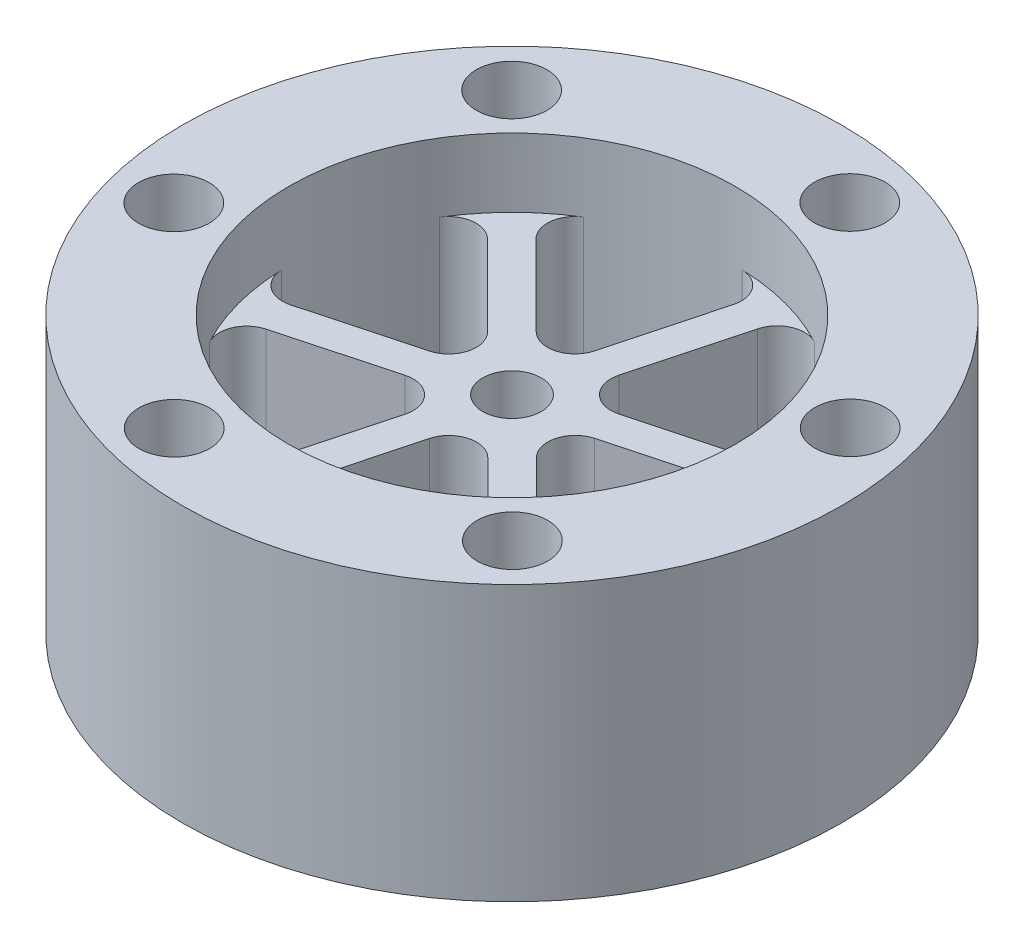
from build123d import *

# Parameters (mm, degrees)
SKETCH1_R                = 30.48
BOSS_EXTRUDE1_DEPTH      = 25.4
F_1_4_28_TAPPED_HOLE1_D  = 5.4102
F_1_4_CLEARANCE_HOLE2_D  = 6.5278
CUT_EXTRUDE1_DEPTH       = 51.032197633
FILLET1_R                = 2.54
CIRPATTERN1_COUNT        = 6
FILLET1_OF_CIRPATTERN1_R = 2.54
SKETCH8_R                = 20.6502
CUT_EXTRUDE2_DEPTH       = 6.35


with BuildPart() as part:
    # Sketch1 → Boss-Extrude1 (new body)
    with BuildSketch(Plane(origin=(0, 0, 0), x_dir=(1, 0, 0), z_dir=(0, 1, 0))):
        with Locations(Location((0, 0, 0), (0, 0, 270))):
            Circle(SKETCH1_R)
    extrude(amount=BOSS_EXTRUDE1_DEPTH)

    # 1/4-28 Tapped Hole1 (through all)
    with Locations(Plane(origin=(0, 25.4, 0), x_dir=(1, 0, 0), z_dir=(0, 1, 0))):
        with Locations((0, 0)):
            Hole(F_1_4_28_TAPPED_HOLE1_D / 2)

    # 1/4 Clearance Hole2 (through all)
    with Locations(Plane(origin=(0, 0, 0), x_dir=(-1, 0, 0), z_dir=(0, -1, 0))):
        with Locations((269.174368783, -128.772908827), (-18.058184892, -18.021920393), (6.578348439, -24.649807059), (-24.636533331, 6.627886666), (-6.578348439, 24.649807059), (18.058184892, 18.021920393), (24.636533331, -6.627886666)):
            Hole(F_1_4_CLEARANCE_HOLE2_D / 2)

    # Sketch7 → Cut-Extrude1 (cut, through all)
    with BuildSketch(Plane(origin=(0, 25.4, 0), x_dir=(1, 0, 0), z_dir=(0, 1, 0))):
        with BuildLine():
            Line((-13.451907307, 15.667704039), (-0.82483254, 3.065987))
            Line((-0.82483254, 3.065987), (3.775037164, 20.302213043))
            ThreePointArc((3.775037164, 20.302213043), (-5.364710837, 19.941179445), (-13.451907307, 15.667704039))
        make_face()
    cut_extrude1 = extrude(amount=-CUT_EXTRUDE1_DEPTH, mode=Mode.SUBTRACT)

    # Fillet1
    fillet1_edges = [part.edges().sort_by_distance(p)[0] for p in [
        (-13.451907307, 12.7, -15.667704039),
        (3.775037164, 12.7, -20.302213043),
        (-0.82483254, 12.7, -3.065987),
    ]]
    fillet(fillet1_edges, radius=FILLET1_R)

    # CirPattern1: Cut-Extrude1 ×6 about axis
    cirpattern1_axis = Axis((0, 0, 0), (0, 1, 0))
    for i in range(1, CIRPATTERN1_COUNT):
        add(cut_extrude1.rotate(cirpattern1_axis, i * 360 / CIRPATTERN1_COUNT), mode=Mode.SUBTRACT)

    # Fillet1 of CirPattern1
    fillet1_of_cirpattern1_edges = [part.edges().sort_by_distance(p)[0] for p in [
        (-20.29458337, 12.7, 3.815841438),
        (-15.694713666, 12.7, -13.420384606),
        (-3.067638899, 12.7, -0.818667567),
        (-6.842676063, 12.7, 19.483545477),
        (-19.46975083, 12.7, 6.881828437),
        (-2.24280636, 12.7, 2.247319433),
        (13.451907307, 12.7, 15.667704039),
        (-3.775037164, 12.7, 20.302213043),
        (0.82483254, 12.7, 3.065987),
        (20.29458337, 12.7, -3.815841438),
        (15.694713666, 12.7, 13.420384606),
        (3.067638899, 12.7, 0.818667567),
        (6.842676063, 12.7, -19.483545477),
        (19.46975083, 12.7, -6.881828437),
        (2.24280636, 12.7, -2.247319433),
    ]]
    fillet(fillet1_of_cirpattern1_edges, radius=FILLET1_OF_CIRPATTERN1_R)

    # Sketch8 → Cut-Extrude2 (cut)
    with BuildSketch(Plane.XZ.offset(-25.4)):
        with Locations(Location((0, 0, 0), (0, 0, 90))):
            Circle(SKETCH8_R)
    extrude(amount=CUT_EXTRUDE2_DEPTH, mode=Mode.SUBTRACT)


solid = part.part
